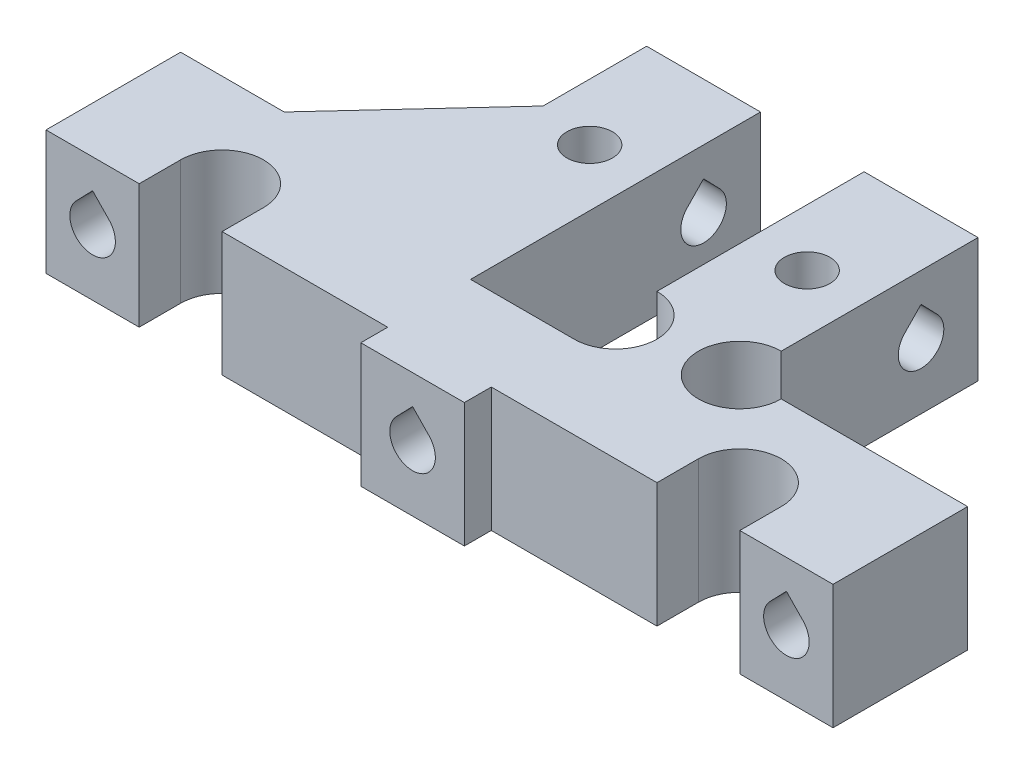
from build123d import *

# Parameters (mm, degrees)
BOSS_EXTRUDE1_DEPTH = 12
CUT_EXTRUDE1_DEPTH  = 54.702886328
CUT_EXTRUDE2_DEPTH  = 54.702886328
SKETCH4_W           = 16
SKETCH4_H           = 2.6
CUT_EXTRUDE3_DEPTH  = 54.702886328
SKETCH5_W           = 33
SKETCH5_H           = 2.6
CUT_EXTRUDE4_DEPTH  = 54.702886328
CUT_EXTRUDE5_DEPTH  = 54.702886328
SKETCH7_W           = 22
SKETCH7_H           = 23
CUT_EXTRUDE6_DEPTH  = 54.702886328
CUT_EXTRUDE7_DEPTH  = 51.019996002
CUT_EXTRUDE8_REACH  = 70.855
CUT_EXTRUDE9_DEPTH  = 58.175169436
CUT_EXTRUDE10_DEPTH = 61.613529843
CUT_EXTRUDE11_DEPTH = 53.507142371
HOLE1_D             = 8
HOLE2_D             = 4.4
HOLE3_D             = 4.4


with BuildPart() as part:
    # Sketch1 → Boss-Extrude1 (new body)
    with BuildSketch(Plane(origin=(0, 23, 0), x_dir=(-1, 0, 0), z_dir=(0, 1, 0))):
        with BuildLine():
            Line((-38, -36), (38, -36))
            Line((38, -36), (38, 0))
            Line((38, 0), (29, 0))
            Line((29, 0), (29, -4))
            ThreePointArc((29, -4), (25, -8), (21, -4))
            Line((21, -4), (21, 2.6))
            Line((21, 2.6), (-38, 2.6))
            Line((-38, 2.6), (-38, -36))
        make_face()
    extrude(amount=-BOSS_EXTRUDE1_DEPTH)

    # Sketch2 → Cut-Extrude1 (cut, through all)
    with BuildSketch(Plane.XZ.offset(-11)):
        with BuildLine():
            Line((-5, -36), (5, -36))
            Line((5, -36), (5, -16))
            ThreePointArc((5, -16), (9, -12), (5, -8))
            Line((5, -8), (-5, -8))
            Line((-5, -8), (-5, -36))
        make_face()
    extrude(amount=-CUT_EXTRUDE1_DEPTH, mode=Mode.SUBTRACT)

    # Sketch3 → Cut-Extrude2 (cut, through all)
    with BuildSketch(Plane.XZ.offset(-11)):
        Polygon((-38, -36), (-16, -36), (-16, -26), (-28, -13), (-38, -13), align=None)
    extrude(amount=-CUT_EXTRUDE2_DEPTH, mode=Mode.SUBTRACT)

    # Sketch4 → Cut-Extrude3 (cut, through all)
    with BuildSketch(Plane.XZ.offset(-11)):
        with Locations((-13, 1.3)):
            Rectangle(SKETCH4_W, SKETCH4_H)
    extrude(amount=-CUT_EXTRUDE3_DEPTH, mode=Mode.SUBTRACT)

    # Sketch5 → Cut-Extrude4 (cut, through all)
    with BuildSketch(Plane.XZ.offset(-11)):
        with Locations((21.5, 1.3)):
            Rectangle(SKETCH5_W, SKETCH5_H)
    extrude(amount=-CUT_EXTRUDE4_DEPTH, mode=Mode.SUBTRACT)

    # Sketch6 → Cut-Extrude5 (cut, through all)
    with BuildSketch(Plane.XZ.offset(-11)):
        with BuildLine():
            Line((29, 0), (21, 0))
            Line((21, 0), (21, -4))
            ThreePointArc((21, -4), (25, -8), (29, -4))
            Line((29, -4), (29, 0))
        make_face()
    extrude(amount=-CUT_EXTRUDE5_DEPTH, mode=Mode.SUBTRACT)

    # Sketch7 → Cut-Extrude6 (cut, through all)
    with BuildSketch(Plane.XZ.offset(-11)):
        with Locations((27, -24.5)):
            Rectangle(SKETCH7_W, SKETCH7_H)
    extrude(amount=-CUT_EXTRUDE6_DEPTH, mode=Mode.SUBTRACT)

    # Sketch8 → Cut-Extrude7 (cut, through all)
    with BuildSketch(Plane(origin=(0, 0, -13), x_dir=(-1, 0, 0), z_dir=(0, 0, -1))):
        with BuildLine():
            Line((35.082547561, 18.528248415), (33.5, 20.167024387))
            Line((33.5, 20.167024387), (31.917452439, 18.528248415))
            ThreePointArc((31.917452439, 18.528248415), (33.5, 14.8), (35.082547561, 18.528248415))
        make_face()
    extrude(amount=-CUT_EXTRUDE7_DEPTH, mode=Mode.SUBTRACT)

    # Sketch9 → Cut-Extrude8 (cut, up to next)
    with BuildSketch(Plane(origin=(16, 0, 0), x_dir=(0, 0, -1), z_dir=(1, 0, 0)), mode=Mode.PRIVATE) as cut_extrude8_sk1:
        with BuildLine():
            Line((32.082547561, 18.528248415), (30.5, 20.167024387))
            Line((30.5, 20.167024387), (28.917452439, 18.528248415))
            ThreePointArc((28.917452439, 18.528248415), (30.5, 14.8), (32.082547561, 18.528248415))
        make_face()
    cut_extrude8_tool1 = extrude(cut_extrude8_sk1.sketch, amount=-CUT_EXTRUDE8_REACH, mode=Mode.PRIVATE) & part.part
    add(cut_extrude8_tool1.solids().sort_by_distance((16, 17.167641, -30.5))[0], mode=Mode.SUBTRACT)

    # Sketch10 → Cut-Extrude9 (cut, through all)
    with BuildSketch(Plane.XY):
        with BuildLine():
            Line((35.082547561, 18.528248415), (33.5, 20.167024387))
            Line((33.5, 20.167024387), (31.917452439, 18.528248415))
            ThreePointArc((31.917452439, 18.528248415), (33.5, 14.8), (35.082547561, 18.528248415))
        make_face()
    extrude(amount=-CUT_EXTRUDE9_DEPTH, mode=Mode.SUBTRACT)

    # Sketch11 → Cut-Extrude10 (cut, through all)
    with BuildSketch(Plane(origin=(-5, 0, 0), x_dir=(0, 0, -1), z_dir=(1, 0, 0))):
        with BuildLine():
            Line((32.082547561, 18.528248415), (30.5, 20.167024387))
            Line((30.5, 20.167024387), (28.917452439, 18.528248415))
            ThreePointArc((28.917452439, 18.528248415), (30.5, 14.8), (32.082547561, 18.528248415))
        make_face()
    extrude(amount=-CUT_EXTRUDE10_DEPTH, mode=Mode.SUBTRACT)

    # Sketch12 → Cut-Extrude11 (cut, through all)
    with BuildSketch(Plane(origin=(0, 0, -8), x_dir=(-1, 0, 0), z_dir=(0, 0, -1))):
        with BuildLine():
            Line((1.582547561, 18.528248415), (0, 20.167024387))
            Line((0, 20.167024387), (-1.582547561, 18.528248415))
            ThreePointArc((-1.582547561, 18.528248415), (0, 14.8), (1.582547561, 18.528248415))
        make_face()
    extrude(amount=-CUT_EXTRUDE11_DEPTH, mode=Mode.SUBTRACT)

    # Hole1 (through all)
    with Locations(Plane.XZ.offset(-11)):
        with Locations((16, -13)):
            Hole(HOLE1_D / 2)

    # Hole2 (through all)
    with Locations(Plane.XZ.offset(-11)):
        with Locations((-10.5, -25)):
            Hole(HOLE2_D / 2)

    # Hole3 (through all)
    with Locations(Plane.XZ.offset(-11)):
        with Locations((10.5, -25)):
            Hole(HOLE3_D / 2)


solid = part.part
